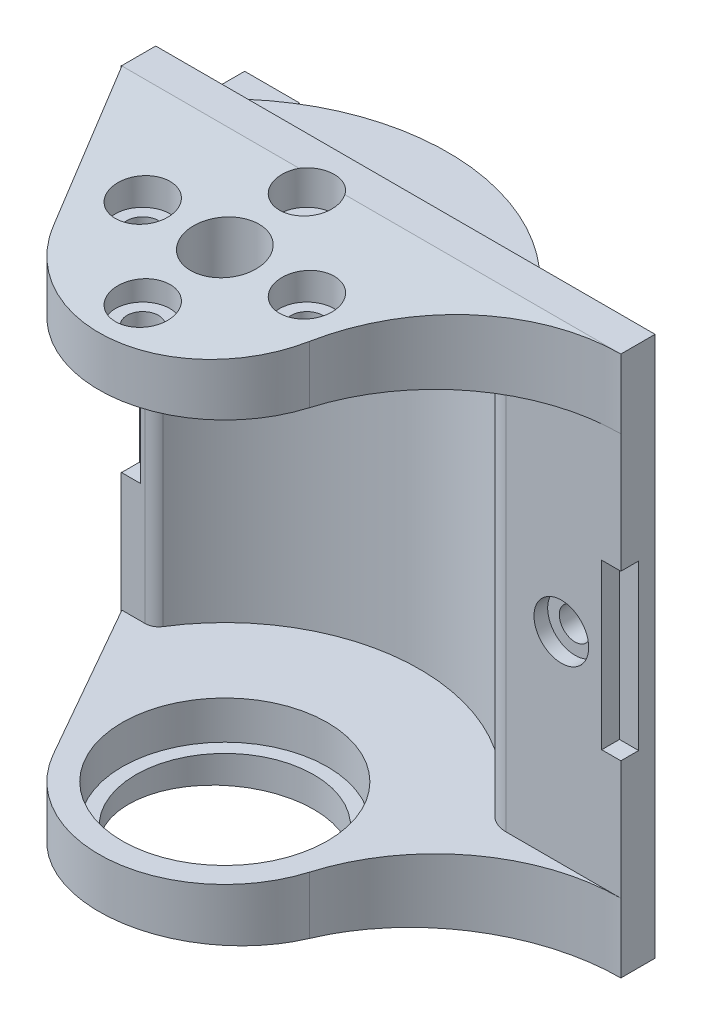
from build123d import *

# Parameters (mm, degrees)
SKETCH_1_R               = 16.3
EXTRUDE_1_DEPTH          = 19.75
SKETCH_2_W               = 36.5
SKETCH_2_H               = 2.5
EXTRUDE_2_DEPTH          = 39.5
SKETCH_3_W               = 44.844436064
SKETCH_3_H               = 25.506740045
CUT_EXTRUDE_1_DEPTH      = 50
EXTRUDE_3_DEPTH          = 5.05
SKETCH_5_R               = 14.25
CUT_EXTRUDE_2_DEPTH      = 29.4
SKETCH_6_R               = 7.5
CUT_EXTRUDE_3_DEPTH      = 44.930797853
CUT_EXTRUDE_5_REACH      = 49.993
SKETCH_8_R               = 1.15
PATTERN_CIRCULAR_1_COUNT = 4
CUT_EXTRUDE_6_REACH      = 49.993
SKETCH_9_R               = 2.5
SKETCH_10_R              = 2
CUT_EXTRUDE_7_DEPTH      = 2.5
EXTRUDE_START            = -2.25
SKETCH_11_R              = 7.5
SKETCH_11_R_2            = 6.5
EXTRUDE_4_DEPTH          = 2.25
SKETCH_12_R              = 1.15
CUT_EXTRUDE_9_DEPTH      = 34.662664779
SKETCH_13_R              = 2
CUT_EXTRUDE_10_DEPTH     = 1
SKETCH_14_W              = 2.8
SKETCH_14_H              = 12
CUT_EXTRUDE_11_DEPTH     = 1.3
SKETCH_15_W              = 2.8
SKETCH_15_H              = 12
CUT_EXTRUDE_12_DEPTH     = 1.3
EXTRUDE_5_REACH          = 40.183
EXTRUDE_5_END_RADIUS     = 16.3
SKETCH_16_W              = 4
SKETCH_16_H              = 5
SKETCH_17_W              = 1
SKETCH_17_H              = 2
CUT_EXTRUDE_13_DEPTH     = 2.5
CUT_EXTRUDE_8_DEPTH      = 45.587021654
SKETCH_18_W              = 26.346157216
SKETCH_18_H              = 2.75
CUT_EXTRUDE_16_DEPTH     = 12.5
FILLET_1_R               = 2
FILLET_2_R               = 1


with BuildPart() as part:
    # 草图1 → 凸台-拉伸1 (new, symmetric)
    with BuildSketch(Plane(origin=(0, 0, 0), x_dir=(1, 0, 0), z_dir=(0, 1, 0))):
        with Locations(Location((0, 0, 0), (0, 0, 270))):
            Circle(SKETCH_1_R)
    extrude(amount=EXTRUDE_1_DEPTH, both=True)

    # 草图2 → 凸台-拉伸2 (add, through all)
    with BuildSketch(Plane.XZ.offset(19.75)):
        with Locations((3.6, -8.35)):
            Rectangle(SKETCH_2_W, SKETCH_2_H)
    extrude(amount=-EXTRUDE_2_DEPTH)

    # 草图3 → 切除-拉伸1 (cut)
    with BuildSketch(Plane.XZ.offset(19.75)):
        with Locations((-0.572218032, 5.653370022)):
            Rectangle(SKETCH_3_W, SKETCH_3_H)
    extrude(amount=-CUT_EXTRUDE_1_DEPTH, mode=Mode.SUBTRACT)

    # 草图4 → 凸台-拉伸3 (add)
    with BuildSketch(Plane.XZ.offset(19.75)):
        with BuildLine():
            Line((-14.65, -7.146152811), (-7.996542478, 4.549209646))
            ThreePointArc((-7.996542478, 4.549209646), (1.047927533, 9.140122969), (8.818653972, 2.621324497))
            ThreePointArc((8.818653972, 2.621324497), (13.721037439, -4.401937543), (21.85, -7.1))
            Line((21.85, -7.1), (-14.65, -7.146152811))
        make_face()
    extrude_3 = extrude(amount=-EXTRUDE_3_DEPTH)

    # 镜向1: 凸台-拉伸3 across plane
    add(extrude_3.mirror(Plane.ZX))

    # 草图5 → 切除-拉伸2 (cut)
    with BuildSketch(Plane(origin=(0, -14.7, 0), x_dir=(1, 0, 0), z_dir=(0, 1, 0))):
        Circle(SKETCH_5_R)
    extrude(amount=CUT_EXTRUDE_2_DEPTH, mode=Mode.SUBTRACT)

    # 草图6 → 切除-拉伸3 (cut, through all)
    with BuildSketch(Plane(origin=(0, -14.7, 0), x_dir=(1, 0, 0), z_dir=(0, 1, 0))):
        with Locations(Location((0, 0, 0), (0, 0, 270))):
            Circle(SKETCH_6_R)
    extrude(amount=-CUT_EXTRUDE_3_DEPTH, mode=Mode.SUBTRACT)

    # 草图8 → 切除-拉伸5 (cut, up to next)
    with BuildSketch(Plane(origin=(0, 19.75, 0), x_dir=(1, 0, 0), z_dir=(0, 1, 0)), mode=Mode.PRIVATE) as cut_extrude_5_sk1:
        with Locations(Location((0, -6, 0), (0, 0, 270))):
            Circle(SKETCH_8_R)
    cut_extrude_5_tool1 = extrude(cut_extrude_5_sk1.sketch, amount=-CUT_EXTRUDE_5_REACH, mode=Mode.PRIVATE) & part.part
    cut_extrude_5 = cut_extrude_5_tool1.solids().sort_by_distance((0, 19.75, 6))[0]
    add(cut_extrude_5, mode=Mode.SUBTRACT)

    # 阵列(圆周)1: 切除-拉伸5 ×4 about axis
    pattern_circular_1_axis = Axis((0, 0, 0), (0, 1, 0))
    for i in range(1, PATTERN_CIRCULAR_1_COUNT):
        add(cut_extrude_5.rotate(pattern_circular_1_axis, i * 360 / PATTERN_CIRCULAR_1_COUNT), mode=Mode.SUBTRACT)

    # 草图9 → 切除-拉伸6 (cut, up to next)
    with BuildSketch(Plane(origin=(0, 19.75, 0), x_dir=(1, 0, 0), z_dir=(0, 1, 0)), mode=Mode.PRIVATE) as cut_extrude_6_sk1:
        with Locations(Location((0, 0, 0), (0, 0, 270))):
            Circle(SKETCH_9_R)
    cut_extrude_6_tool1 = extrude(cut_extrude_6_sk1.sketch, amount=-CUT_EXTRUDE_6_REACH, mode=Mode.PRIVATE) & part.part
    add(cut_extrude_6_tool1.solids().sort_by_distance((0, 19.75, 0))[0], mode=Mode.SUBTRACT)

    # 草图10 → 切除-拉伸7 (cut)
    with BuildSketch(Plane(origin=(0, 19.75, 0), x_dir=(1, 0, 0), z_dir=(0, 1, 0))):
        with Locations(Location((0, 6, 0), (0, 0, 270))):
            Circle(SKETCH_10_R)
        with Locations(Location((6, 0, 0), (0, 0, 270))):
            Circle(SKETCH_10_R)
        with Locations(Location((-6, 0, 0), (0, 0, 270))):
            Circle(SKETCH_10_R)
        with Locations(Location((0, -6, 0), (0, 0, 270))):
            Circle(SKETCH_10_R)
    extrude(amount=-CUT_EXTRUDE_7_DEPTH, mode=Mode.SUBTRACT)

    # 草图11 → 凸台-拉伸4 (add)
    with BuildSketch(Plane.XZ.offset(19.75).offset(EXTRUDE_START)):
        with Locations(Location((0, 0, 0), (0, 0, 90))):
            Circle(SKETCH_11_R)
        with Locations(Location((0, 0, 0), (0, 0, 270))):
            Circle(SKETCH_11_R_2, mode=Mode.SUBTRACT)
    extrude(amount=EXTRUDE_4_DEPTH)

    # 草图12 → 切除-拉伸9 (cut, through all)
    with BuildSketch(Plane.XY.offset(-7.1)):
        with Locations((17.5, 0)):
            Circle(SKETCH_12_R)
    extrude(amount=-CUT_EXTRUDE_9_DEPTH, mode=Mode.SUBTRACT)

    # 草图13 → 切除-拉伸10 (cut)
    with BuildSketch(Plane.XY.offset(-7.1)):
        with Locations((17.5, 0)):
            Circle(SKETCH_13_R)
    extrude(amount=-CUT_EXTRUDE_10_DEPTH, mode=Mode.SUBTRACT)

    # 草图14 → 切除-拉伸11 (cut)
    with BuildSketch(Plane.XY.offset(-7.1)):
        with Locations((21.85, 0)):
            Rectangle(SKETCH_14_W, SKETCH_14_H)
    extrude(amount=-CUT_EXTRUDE_11_DEPTH, mode=Mode.SUBTRACT)

    # 草图15 → 切除-拉伸12 (cut)
    with BuildSketch(Plane.XY.offset(-7.1)):
        with Locations((-14.672423113, 0)):
            Rectangle(SKETCH_15_W, SKETCH_15_H)
    extrude(amount=-CUT_EXTRUDE_12_DEPTH, mode=Mode.SUBTRACT)

    # 凸台-拉伸5: up to this cylinder (the profile starts outside it)
    extrude_5_end = Plane(origin=(0, 13.4, 0), z_dir=(0, -1, 0)) * Cylinder(EXTRUDE_5_END_RADIUS, 113.966, mode=Mode.PRIVATE)
    # 草图16 → 凸台-拉伸5 (add, up to the surface)
    with BuildSketch(Plane(origin=(0, 0, -15.1), x_dir=(-1, 0, 0), z_dir=(0, 0, -1)), mode=Mode.PRIVATE) as extrude_5_sk1:
        with Locations((11.65, 13.4)):
            Rectangle(SKETCH_16_W, SKETCH_16_H)
    extrude_5_tool1 = extrude(extrude_5_sk1.sketch, amount=-EXTRUDE_5_REACH, mode=Mode.PRIVATE) - extrude_5_end
    extrude_5 = extrude_5_tool1.solids().sort_by_distance((-11.65, 13.4, -15.1))[0]
    add(extrude_5)

    # 镜向4: 凸台-拉伸5 across plane
    add(extrude_5.mirror(Plane.ZX))

    # 草图17 → 切除-拉伸13 (cut)
    with BuildSketch(Plane(origin=(0, 0, -15.1), x_dir=(-1, 0, 0), z_dir=(0, 0, -1))):
        with Locations((11.65, 13.4)):
            Rectangle(SKETCH_17_W, SKETCH_17_H)
    cut_extrude_13 = extrude(amount=-CUT_EXTRUDE_13_DEPTH, mode=Mode.SUBTRACT)

    # 镜向5: 切除-拉伸13 across plane
    add(cut_extrude_13.mirror(Plane.ZX), mode=Mode.SUBTRACT)

    # 草图7 → 切除-拉伸8 (cut, through all)
    with BuildSketch(Plane.ZY.offset(14.65)):
        Polygon((-7.1, 19.75), (9.2, 18.323934785), (9.2, 19.75), align=None)
    cut_extrude_8 = extrude(amount=-CUT_EXTRUDE_8_DEPTH, mode=Mode.SUBTRACT)

    # 镜向3: 切除-拉伸8 across plane
    add(cut_extrude_8.mirror(Plane.ZX), mode=Mode.SUBTRACT)

    # 草图18 → 切除-拉伸16 (cut)
    with BuildSketch(Plane(origin=(0, 0, -9.6), x_dir=(-1, 0, 0), z_dir=(0, 0, -1))):
        with Locations((0, 18.375)):
            Rectangle(SKETCH_18_W, SKETCH_18_H)
    cut_extrude_16 = extrude(amount=CUT_EXTRUDE_16_DEPTH, mode=Mode.SUBTRACT)

    # 镜向6: 切除-拉伸16 across plane
    add(cut_extrude_16.mirror(Plane.ZX), mode=Mode.SUBTRACT)

    # 圆角1
    fillet_1_edges = [part.edges().sort_by_distance(p)[0] for p in [
        (12.355262037, 0, -7.1),
    ]]
    fillet(fillet_1_edges, radius=FILLET_1_R)

    # 圆角2
    fillet_2_edges = [part.edges().sort_by_distance(p)[0] for p in [
        (-12.355262037, 0, -7.1),
    ]]
    fillet(fillet_2_edges, radius=FILLET_2_R)


solid = part.part
